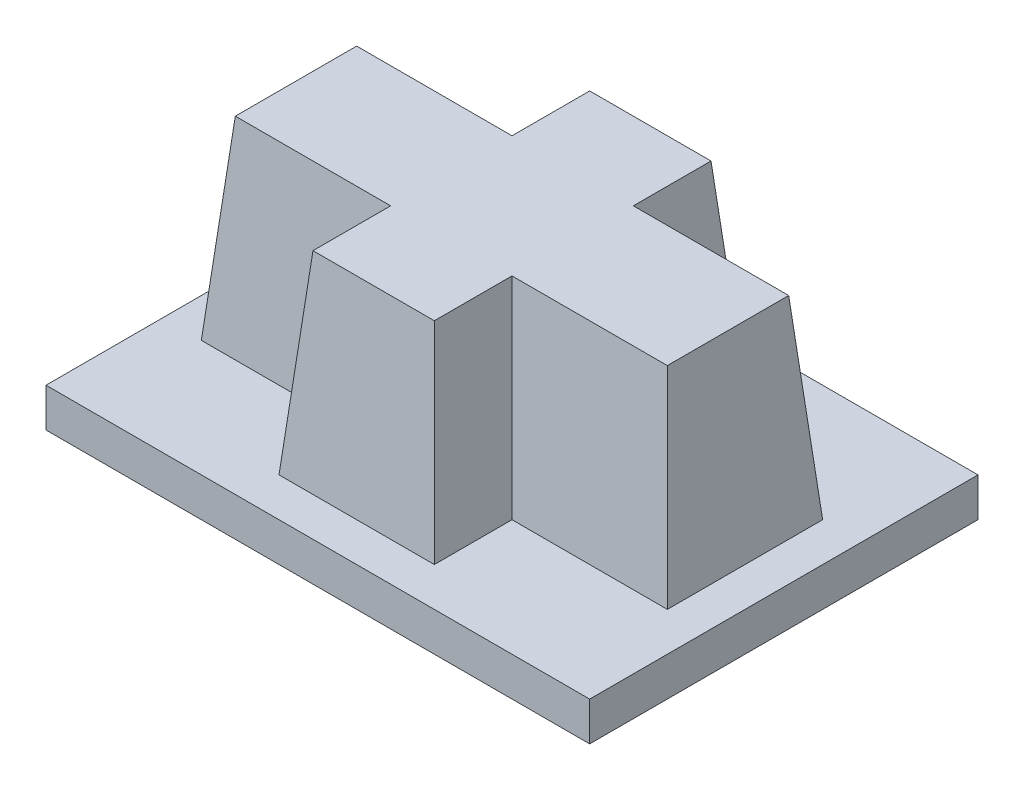
from build123d import *

# Parameters (mm, degrees)
SKETCH_1_W      = 140
SKETCH_1_H      = 100
EXTRUDE_1_DEPTH = 10
EXTRUDE_2_DEPTH = 50
EXTRUDE_2_TAPER = 5


with BuildPart() as part:
    # 스케치1 → 보스-돌출1 (new body)
    with BuildSketch(Plane(origin=(0, 0, 0), x_dir=(1, 0, 0), z_dir=(0, 1, 0))):
        Rectangle(SKETCH_1_W, SKETCH_1_H)
    extrude(amount=EXTRUDE_1_DEPTH)

    # 스케치2 → 보스-돌출2 (add)
    with BuildSketch(Plane(origin=(0, 10, 0), x_dir=(1, 0, 0), z_dir=(0, 1, 0))):
        Polygon((20, 20), (20, 40), (-20, 40), (-20, 20), (-60, 20), (-60, -20), (-20, -20), (-20, -40), (20, -40), (20, -20), (60, -20), (60, 20), align=None)
    extrude(amount=EXTRUDE_2_DEPTH, taper=EXTRUDE_2_TAPER)


solid = part.part
